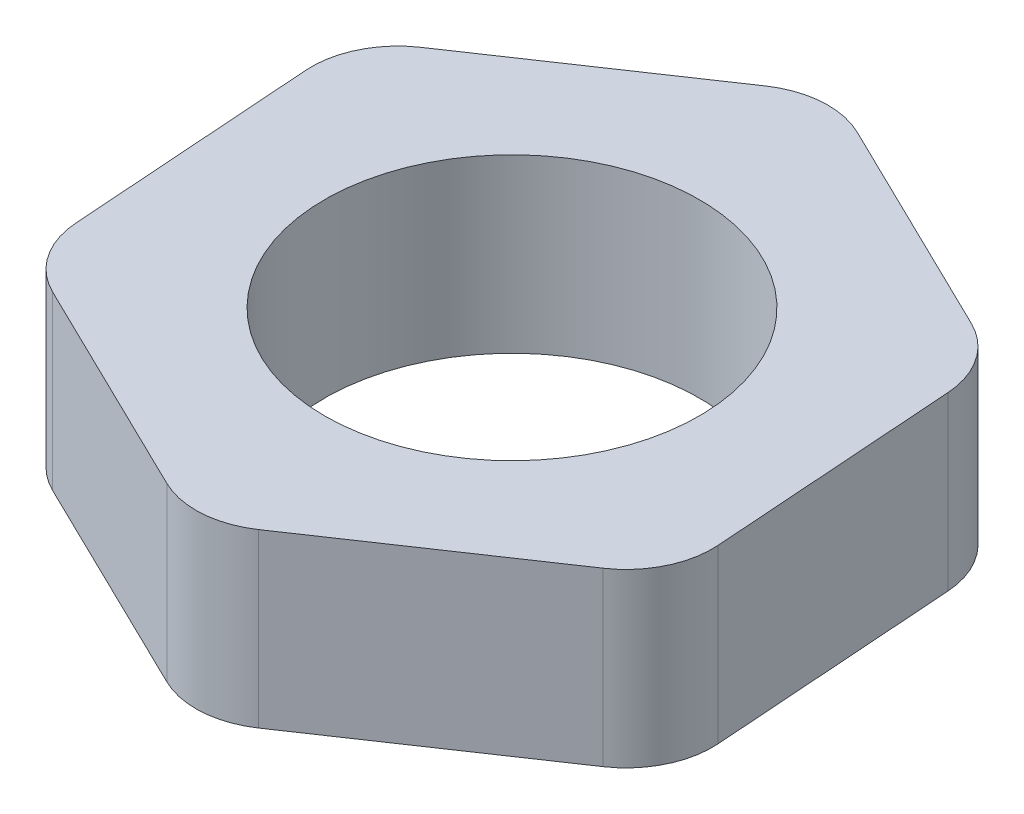
from build123d import *

# Parameters (mm, degrees)
SKETCH1_R           = 1.09
BOSS_EXTRUDE1_DEPTH = 1
FILLET1_R           = 0.5


with BuildPart() as part:
    # Sketch1 → Boss-Extrude1 (new body)
    with BuildSketch(Plane(origin=(0, 0, 0), x_dir=(1, 0, 0), z_dir=(0, 1, 0))):
        Polygon((-0.141418408, 2.015771358), (-1.816418408, 0.885413745), (-1.675, -1.130357613), (0.141418408, -2.015771358), (1.816418408, -0.885413745), (1.675, 1.130357613), align=None)
        with Locations(Location((0, 0, 0), (0, 0, 270))):
            Circle(SKETCH1_R, mode=Mode.SUBTRACT)
    extrude(amount=BOSS_EXTRUDE1_DEPTH)

    # Fillet1
    fillet1_edges = [part.edges().sort_by_distance(p)[0] for p in [
        (1.675, 0.5, -1.130357613),
        (1.816418408, 0.5, 0.885413745),
        (0.141418408, 0.5, 2.015771358),
        (-1.675, 0.5, 1.130357613),
        (-1.816418408, 0.5, -0.885413745),
        (-0.141418408, 0.5, -2.015771358),
    ]]
    fillet(fillet1_edges, radius=FILLET1_R)


solid = part.part
